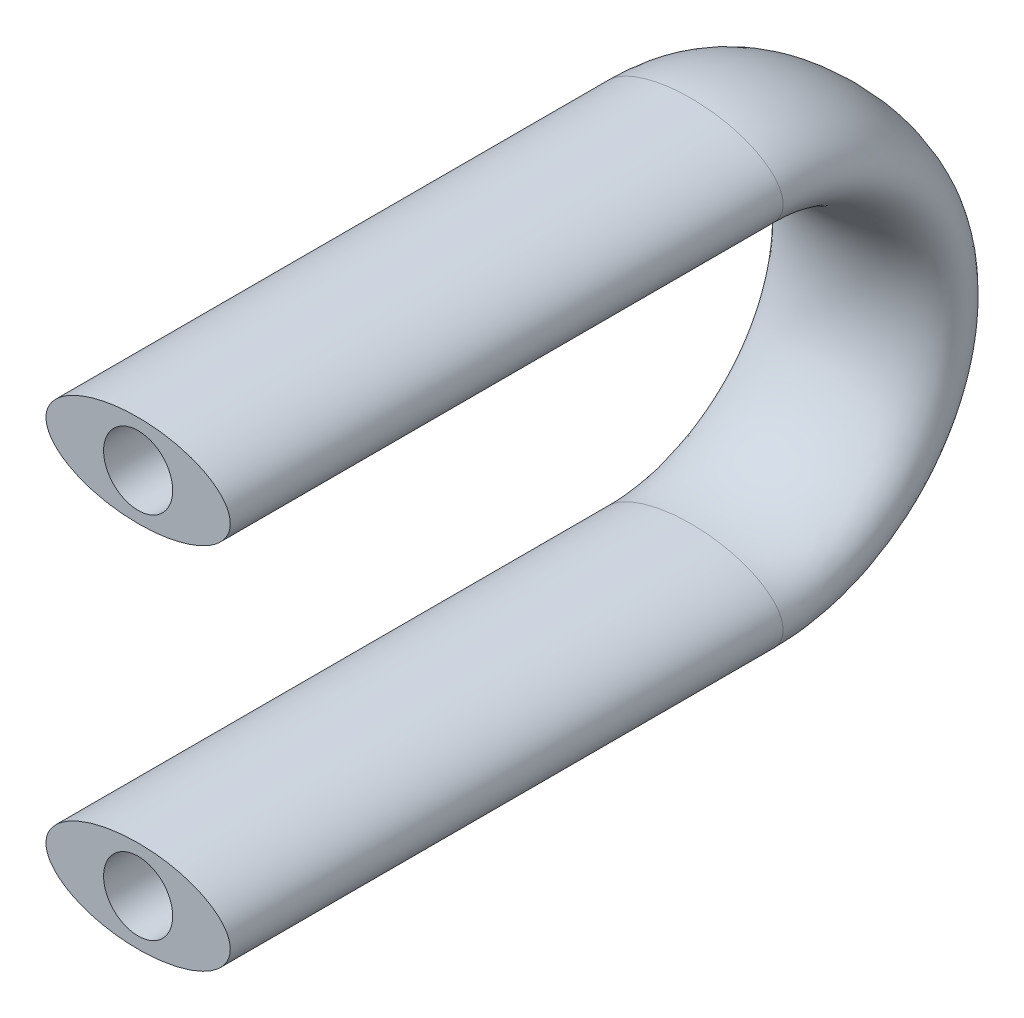
from build123d import *

# Parameters (mm, degrees)
SKETCH4_RX = 50.8
SKETCH4_RY = 25.4
SKETCH4_R  = 19.05


with BuildPart() as part:
    # Sweep2: sweep along a path in Sketch1
    with BuildLine(Plane(origin=(0, 0, 0), x_dir=(0, 0, -1), z_dir=(1, 0, 0))) as sweep2_path:
        Line((0, 0), (304.8, 0))
        ThreePointArc((304.8, 0), (406.4, 101.6), (304.8, 203.2))
        Line((304.8, 203.2), (0, 203.2))
    # Sketch4 → Sweep2 (sweep)
    with BuildSketch(Plane.XY):
        with Locations(Location((0, 0), (0, 0, 180))):
            Ellipse(SKETCH4_RX, SKETCH4_RY)
        Circle(SKETCH4_R, mode=Mode.SUBTRACT)
    sweep(path=sweep2_path.line)


solid = part.part
